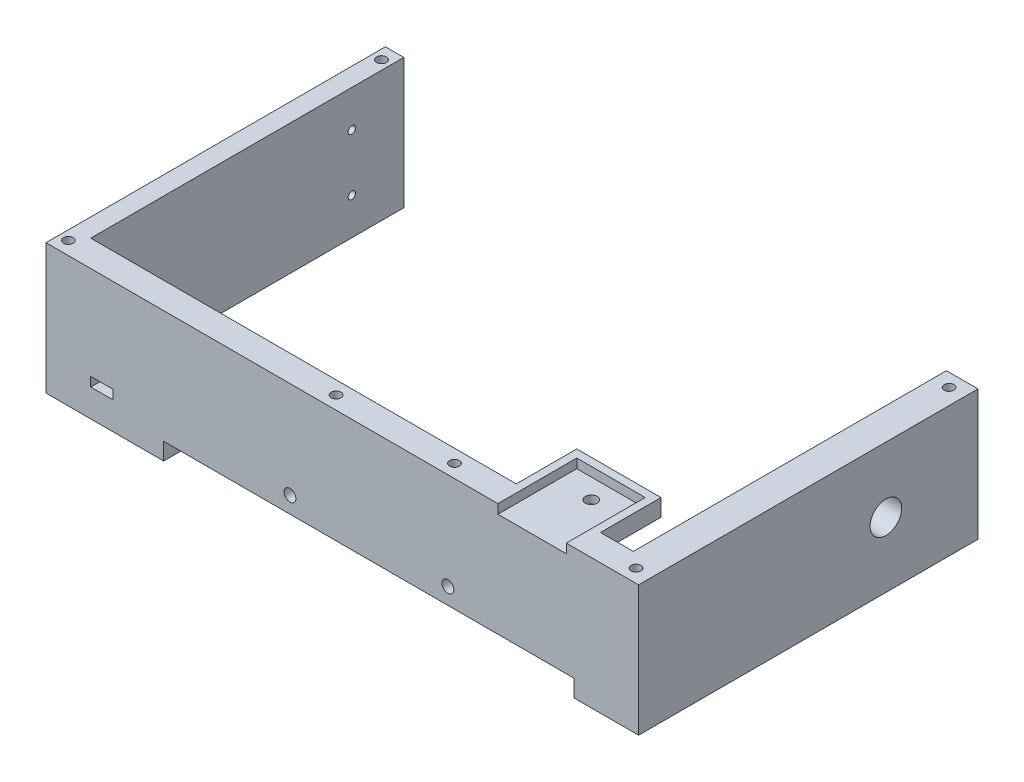
from build123d import *

# Parameters (mm, degrees)
SKETCH1_W                      = 129
SKETCH1_H                      = 55.5
BOSS_EXTRUDE1_DEPTH            = 98.12
SKETCH18_W                     = 129
SKETCH18_H                     = 55.5
BOSS_EXTRUDE9_DEPTH            = 29
SKETCH33_W                     = 156
SKETCH33_H                     = 12.5
CUT_EXTRUDE8_DEPTH             = 20.5
SKETCH40_W                     = 206.24
SKETCH40_H                     = 49.5
CUT_EXTRUDE9_DEPTH             = 119
CUT_EXTRUDE18_REACH            = 191.422
SKETCH62_W                     = 8.5
SKETCH62_H                     = 3.5
M4_CLEARANCE_HOLE2_D           = 4.5
F_2_0_221_DIAMETER_HOLE1_D     = 2.50000008
F_2_0_221_DIAMETER_HOLE1_DEPTH = 20
F_2_0_221_DIAMETER_HOLE1_TIP   = 0.751075798
SKETCH70_W                     = 32
SKETCH70_H                     = 6.5
BOSS_EXTRUDE10_DEPTH           = 23
SKETCH71_W                     = 26
SKETCH71_H                     = 3.5
CUT_EXTRUDE19_DEPTH            = 30
SKETCH73_W                     = 225.24
SKETCH73_H                     = 6
CUT_EXTRUDE20_DEPTH            = 190.422132815
F_3_7_3_7_DIAMETER_HOLE1_D     = 3.7
F_3_7_3_7_DIAMETER_HOLE1_DEPTH = 12
F_3_7_3_7_DIAMETER_HOLE1_TIP   = 1.111592145
F_3_7_3_7_DIAMETER_HOLE2_D     = 3.7
F_3_7_3_7_DIAMETER_HOLE2_DEPTH = 12
F_3_7_3_7_DIAMETER_HOLE2_TIP   = 1.111592145
M4_CLEARANCE_HOLE3_D           = 4.5
M4_CLEARANCE_HOLE3_DEPTH       = 12
M4_CLEARANCE_HOLE3_TIP         = 1.351936393
F_3_CLEARANCE_HOLE1_D          = 2.794
F_3_CLEARANCE_HOLE1_DEPTH      = 7
F_12_0MM_DOWEL_HOLE1_D         = 12
F_12_0MM_DOWEL_HOLE1_DEPTH     = 12


with BuildPart() as part:
    # Sketch1 → Boss-Extrude1 (new, symmetric)
    with BuildSketch(Plane(origin=(0, 0, 0), x_dir=(0, 0, -1), z_dir=(1, 0, 0))):
        with Locations((64.5, 27.75)):
            Rectangle(SKETCH1_W, SKETCH1_H)
    extrude(amount=BOSS_EXTRUDE1_DEPTH, both=True)

    # Sketch18 → Boss-Extrude9 (add)
    with BuildSketch(Plane.ZY.offset(98.12)):
        with Locations((-64.5, 27.75)):
            Rectangle(SKETCH18_W, SKETCH18_H)
    extrude(amount=BOSS_EXTRUDE9_DEPTH)

    # Sketch33 → Cut-Extrude8 (cut)
    with BuildSketch(Plane.XY):
        with Locations((-4.38, 6.25)):
            Rectangle(SKETCH33_W, SKETCH33_H)
    extrude(amount=-CUT_EXTRUDE8_DEPTH, mode=Mode.SUBTRACT)

    # Sketch40 → Cut-Extrude9 (cut)
    with BuildSketch(Plane(origin=(0, 0, -129), x_dir=(-1, 0, 0), z_dir=(0, 0, -1))):
        with Locations((17, 30.75)):
            Rectangle(SKETCH40_W, SKETCH40_H)
    extrude(amount=-CUT_EXTRUDE9_DEPTH, mode=Mode.SUBTRACT)

    # Sketch62 → Cut-Extrude18 (cut, up to next)
    with BuildSketch(Plane.XY, mode=Mode.PRIVATE) as cut_extrude18_sk1:
        with Locations((-105.87, 18.25)):
            Rectangle(SKETCH62_W, SKETCH62_H)
    cut_extrude18_tool1 = extrude(cut_extrude18_sk1.sketch, amount=-CUT_EXTRUDE18_REACH, mode=Mode.PRIVATE) & part.part
    add(cut_extrude18_tool1.solids().sort_by_distance((-105.87, 18.25, 0))[0], mode=Mode.SUBTRACT)

    # M4 Clearance Hole2 (through all)
    with Locations(Plane.XY):
        with Locations((-34.375, 18.75), (25.625, 18.75)):
            Hole(M4_CLEARANCE_HOLE2_D / 2)

    # #2 (0.221) Diameter Hole1
    with Locations(Plane(origin=(0, 0, -129), x_dir=(-1, 0, 0), z_dir=(0, 0, -1))):
        with Locations((-91.573125, 38.6875), (-91.573125, 22.8125)):
            Hole(F_2_0_221_DIAMETER_HOLE1_D / 2, depth=F_2_0_221_DIAMETER_HOLE1_DEPTH)
            with Locations((0, 0, -(F_2_0_221_DIAMETER_HOLE1_DEPTH + F_2_0_221_DIAMETER_HOLE1_TIP / 2))):  # 118° drill point
                Cone(0, F_2_0_221_DIAMETER_HOLE1_D / 2, F_2_0_221_DIAMETER_HOLE1_TIP, mode=Mode.SUBTRACT)

    # Sketch70 → Boss-Extrude10 (add)
    with BuildSketch(Plane(origin=(0, 0, -10), x_dir=(-1, 0, 0), z_dir=(0, 0, -1))):
        with Locations((-57.63, 52.25)):
            Rectangle(SKETCH70_W, SKETCH70_H)
    extrude(amount=BOSS_EXTRUDE10_DEPTH)

    # Sketch71 → Cut-Extrude19 (cut)
    with BuildSketch(Plane.XY):
        with Locations((57.63, 53.75)):
            Rectangle(SKETCH71_W, SKETCH71_H)
    extrude(amount=-CUT_EXTRUDE19_DEPTH, mode=Mode.SUBTRACT)

    # Sketch73 → Cut-Extrude20 (cut, through all)
    with BuildSketch(Plane(origin=(0, 0, -129), x_dir=(-1, 0, 0), z_dir=(0, 0, -1))):
        with Locations((14.5, 3)):
            Rectangle(SKETCH73_W, SKETCH73_H)
    extrude(amount=-CUT_EXTRUDE20_DEPTH, mode=Mode.SUBTRACT)

    # Ø3.7 (3.7) Diameter Hole1
    with Locations(Plane(origin=(0, 55.5, 0), x_dir=(1, 0, 0), z_dir=(0, 1, 0))):
        with Locations((92.12, 124), (92.12, 5), (-123.62, 124), (-123.62, 5), (23.14, 5), (-21.86, 5)):
            Hole(F_3_7_3_7_DIAMETER_HOLE1_D / 2, depth=F_3_7_3_7_DIAMETER_HOLE1_DEPTH)
            with Locations((0, 0, -(F_3_7_3_7_DIAMETER_HOLE1_DEPTH + F_3_7_3_7_DIAMETER_HOLE1_TIP / 2))):  # 118° drill point
                Cone(0, F_3_7_3_7_DIAMETER_HOLE1_D / 2, F_3_7_3_7_DIAMETER_HOLE1_TIP, mode=Mode.SUBTRACT)

    # Ø3.7 (3.7) Diameter Hole2
    with Locations(Plane(origin=(0, 6, 0), x_dir=(-1, 0, 0), z_dir=(0, -1, 0))):
        with Locations((-92.12, 124), (-92.12, 5), (123.62, 5), (123.62, 124)):
            Hole(F_3_7_3_7_DIAMETER_HOLE2_D / 2, depth=F_3_7_3_7_DIAMETER_HOLE2_DEPTH)
            with Locations((0, 0, -(F_3_7_3_7_DIAMETER_HOLE2_DEPTH + F_3_7_3_7_DIAMETER_HOLE2_TIP / 2))):  # 118° drill point
                Cone(0, F_3_7_3_7_DIAMETER_HOLE2_D / 2, F_3_7_3_7_DIAMETER_HOLE2_TIP, mode=Mode.SUBTRACT)

    # M4 Clearance Hole3
    with Locations(Plane(origin=(0, 52, 0), x_dir=(1, 0, 0), z_dir=(0, 1, 0))):
        with Locations((57.63, 22.5)):
            Hole(M4_CLEARANCE_HOLE3_D / 2, depth=M4_CLEARANCE_HOLE3_DEPTH)
            with Locations((0, 0, -(M4_CLEARANCE_HOLE3_DEPTH + M4_CLEARANCE_HOLE3_TIP / 2))):  # 118° drill point
                Cone(0, M4_CLEARANCE_HOLE3_D / 2, M4_CLEARANCE_HOLE3_TIP, mode=Mode.SUBTRACT)

    # #3 Clearance Hole1
    with Locations(Plane.ZY.offset(127.12)):
        with Locations((-109.25, 41.5), (-109.25, 20)):
            Hole(F_3_CLEARANCE_HOLE1_D / 2, depth=F_3_CLEARANCE_HOLE1_DEPTH)

    # Ø12.0mm Dowel Hole1
    with Locations(Plane.ZY.offset(-86.12)):
        with Locations((-94, 30.75)):
            Hole(F_12_0MM_DOWEL_HOLE1_D / 2, depth=F_12_0MM_DOWEL_HOLE1_DEPTH)


solid = part.part
